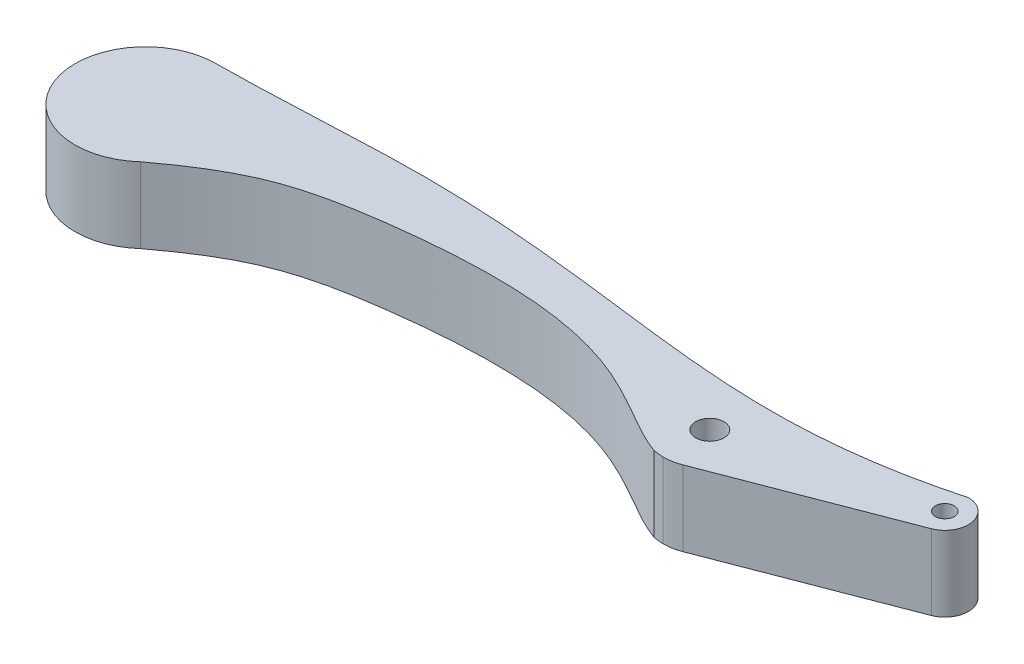
from build123d import *

# Parameters (mm, degrees)
SKETCH1_R           = 1.5
SKETCH1_R_2         = 1
BOSS_EXTRUDE2_DEPTH = 8
SKETCH2_R           = 7.5
BOSS_EXTRUDE3_DEPTH = 8


with BuildPart() as part:
    # Sketch1 → Boss-Extrude2 (new body)
    # profile 1 of 4: a face of its own
    with BuildSketch(Plane(origin=(0, 0, 0), x_dir=(1, 0, 0), z_dir=(0, 1, 0))):
        with BuildLine():
            add(Edge.make_bspline(
                [(0, 7.5), (6.596187394, 7.530426185), (32.040629727, 9.552748983), (47.680162141, 5.252923941), (59.999992635, 5.029728583)],
                knots=[0, 0, 0, 0, 0.213970645, 0.739192017, 0.739192017, 0.739192017, 0.739192017], degree=3))
            ThreePointArc((0, 7.5), (0.308522592, 7.493651567), (0.616522882, 7.474617016))
            ThreePointArc((0.616522882, 7.474617016), (5.516970256, 5.080653422), (7.5, 0))
            ThreePointArc((7.5, 0), (6.856742789, -3.038927168), (5.037312445, -5.556571185))
            add(Edge.make_bspline(
                [(5.037312445, -5.556571185), (8.021571505, -3.32285112), (13.635815208, 0.236701705), (44.65251234, 5.656319828), (51.140486121, -1.084197644), (57.125362445, -4.061298338)],
                knots=[0.020667052, 0.020667052, 0.020667052, 0.020667052, 0.119805518, 0.217738813, 0.928025961, 0.928025961, 0.928025961, 0.928025961], degree=3))
            ThreePointArc((57.125362445, -4.061298338), (55.232648794, 1.537187603), (59.999992635, 5.029728583))
        make_face()
    # profile 2 of 4: a face of its own
    with BuildSketch(Plane(origin=(0, 0, 0), x_dir=(1, 0, 0), z_dir=(0, 1, 0))):
        with BuildLine():
            add(Edge.make_bspline(
                [(59.999992635, 5.029728583), (60.056770721, 5.028699949), (60.113574452, 5.027731465), (60.17040443, 5.026823721)],
                knots=[0.739192017, 0.739192017, 0.739192017, 0.739192017, 0.741612591, 0.741612591, 0.741612591, 0.741612591], degree=3))
            ThreePointArc((59.999992635, 5.029728583), (55.232648794, 1.537187603), (57.125362445, -4.061298338))
            add(Edge.make_bspline(
                [(57.125362445, -4.061298338), (57.731815374, -4.362970643), (58.341174751, -4.634386804), (58.97072282, -4.863185032)],
                knots=[0.928025961, 0.928025961, 0.928025961, 0.928025961, 1, 1, 1, 1], degree=3))
            add(Edge.make_bspline(
                [(58.97072282, -4.863185032), (58.978140323, -4.863203707), (59.992575824, -4.970257084), (59.999992635, -4.970271417)],
                knots=[0.71419854, 0.71419854, 0.71419854, 0.71419854, 0.714487623, 0.714487623, 0.714487623, 0.714487623], degree=3))
            ThreePointArc((59.999992635, -4.970271417), (60.911235507, -4.886533862), (61.791956278, -4.638125988))
            ThreePointArc((61.791956278, -4.638125988), (64.120661162, -2.802247916), (64.999992635, 0.029728583))
            ThreePointArc((64.999992635, 0.029728583), (63.595271413, 3.504490519), (60.17040443, 5.026823721))
        make_face()
        with Locations(Location((59.999992635, 0.029728583, 0), (0, 0, 270))):
            Circle(SKETCH1_R, mode=Mode.SUBTRACT)
    # profile 3 of 4: a face of its own
    with BuildSketch(Plane(origin=(0, 0, 0), x_dir=(1, 0, 0), z_dir=(0, 1, 0))):
        with BuildLine():
            add(Edge.make_bspline(
                [(60.17040443, 5.026823721), (65.898598948, 4.935327468), (71.893463692, 5.460936259), (78.772237812, 7.207483871)],
                knots=[0.741612591, 0.741612591, 0.741612591, 0.741612591, 0.985595086, 0.985595086, 0.985595086, 0.985595086], degree=3))
            ThreePointArc((60.17040443, 5.026823721), (63.595271413, 3.504490519), (64.999992635, 0.029728583))
            ThreePointArc((64.999992635, 0.029728583), (64.120661162, -2.802247916), (61.791956278, -4.638125988))
            Line((61.791956278, -4.638125988), (80.895974457, 2.695801297))
            ThreePointArc((80.895974457, 2.695801297), (77.738060222, 3.964993049), (78.772237812, 7.207483871))
        make_face()
    # profile 4 of 4: a face of its own
    with BuildSketch(Plane(origin=(0, 0, 0), x_dir=(1, 0, 0), z_dir=(0, 1, 0))):
        with BuildLine():
            add(Edge.make_bspline(
                [(78.772237812, 7.207483871), (79.178365934, 7.310601387), (79.587575198, 7.417974867), (79.999992635, 7.529728583)],
                knots=[0.985595086, 0.985595086, 0.985595086, 0.985595086, 1, 1, 1, 1], degree=3))
            ThreePointArc((78.772237812, 7.207483871), (77.738060222, 3.964993049), (80.895974457, 2.695801297))
            ThreePointArc((80.895974457, 2.695801297), (82.060326898, 3.613740334), (82.499992635, 5.029728583))
            ThreePointArc((82.499992635, 5.029728583), (81.767759588, 6.797495536), (79.999992635, 7.529728583))
        make_face()
        with Locations(Location((79.999992635, 5.029728583, 0), (0, 0, 270))):
            Circle(SKETCH1_R_2, mode=Mode.SUBTRACT)
    extrude(amount=BOSS_EXTRUDE2_DEPTH)

    # Sketch2 → Boss-Extrude3 (add)
    with BuildSketch(Plane(origin=(0, 0, 0), x_dir=(1, 0, 0), z_dir=(0, 1, 0))):
        Circle(SKETCH2_R)
    extrude(amount=BOSS_EXTRUDE3_DEPTH)


solid = part.part
